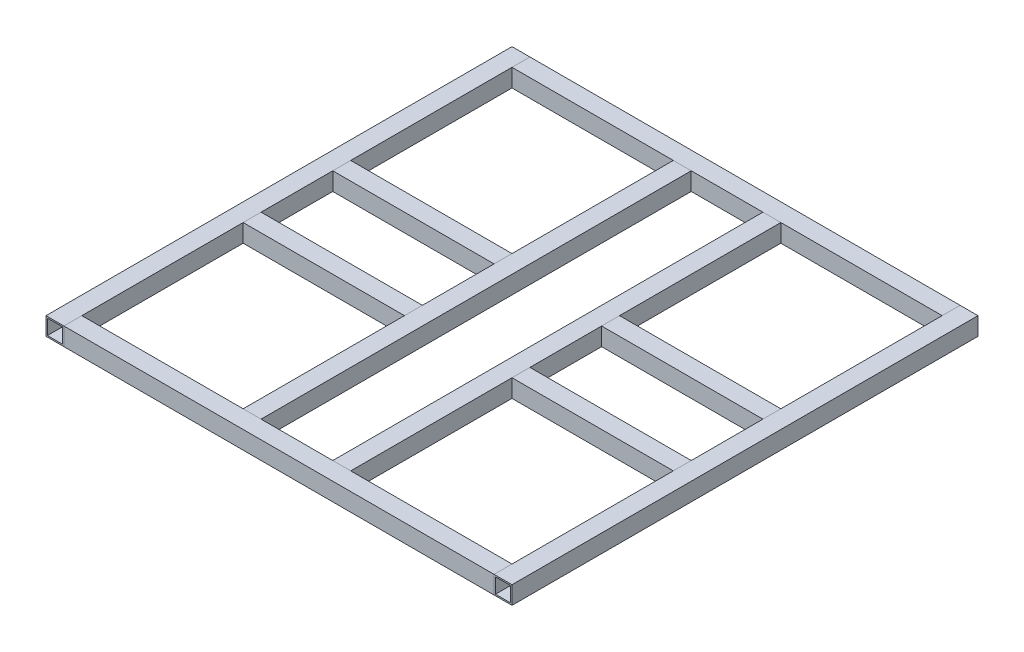
from build123d import *

# Parameters (mm, degrees)
INOX_VU_NG_CONFIGURED_10X0_8_1_DEPTH      = 255
INOX_VU_NG_CONFIGURED_10X0_8_1_DEPTH_BACK = 5
SKETCH11_W                                = 10
SKETCH11_H                                = 10
SKETCH11_W_2                              = 8.4
SKETCH11_H_2                              = 8.4
SKETCH11_ON_SEGMENT_2_W                   = 10
SKETCH11_ON_SEGMENT_2_H                   = 10
SKETCH11_ON_SEGMENT_2_W_2                 = 8.4
SKETCH11_ON_SEGMENT_2_H_2                 = 8.4
INOX_VU_NG_CONFIGURED_10X0_8_1_2_DEPTH    = 252
SKETCH11_ON_SEGMENT_3_W                   = 10
SKETCH11_ON_SEGMENT_3_H                   = 10
SKETCH11_ON_SEGMENT_3_W_2                 = 8.4
SKETCH11_ON_SEGMENT_3_H_2                 = 8.4
INOX_VU_NG_CONFIGURED_10X0_8_1_3_DEPTH    = 252
SKETCH11_ON_SEGMENT_4_W                   = 10
SKETCH11_ON_SEGMENT_4_H                   = 10
SKETCH11_ON_SEGMENT_4_W_2                 = 8.4
SKETCH11_ON_SEGMENT_4_H_2                 = 8.4
INOX_VU_NG_CONFIGURED_10X0_8_1_4_DEPTH    = 260
SKETCH11_ON_SEGMENT_5_W                   = 10
SKETCH11_ON_SEGMENT_5_H                   = 10
SKETCH11_ON_SEGMENT_5_W_2                 = 8.4
SKETCH11_ON_SEGMENT_5_H_2                 = 8.4
INOX_VU_NG_CONFIGURED_10X0_8_1_5_DEPTH    = 252
SKETCH11_ON_SEGMENT_6_W                   = 10
SKETCH11_ON_SEGMENT_6_H                   = 10
SKETCH11_ON_SEGMENT_6_W_2                 = 8.4
SKETCH11_ON_SEGMENT_6_H_2                 = 8.4
INOX_VU_NG_CONFIGURED_10X0_8_1_6_DEPTH    = 252
SKETCH11_ON_SEGMENT_7_W                   = 10
SKETCH11_ON_SEGMENT_7_H                   = 10
SKETCH11_ON_SEGMENT_7_W_2                 = 8.4
SKETCH11_ON_SEGMENT_7_H_2                 = 8.4
INOX_VU_NG_CONFIGURED_10X0_8_1_7_DEPTH    = 102
SKETCH11_ON_SEGMENT_8_W                   = 10
SKETCH11_ON_SEGMENT_8_H                   = 10
SKETCH11_ON_SEGMENT_8_W_2                 = 8.4
SKETCH11_ON_SEGMENT_8_H_2                 = 8.4
INOX_VU_NG_CONFIGURED_10X0_8_1_8_DEPTH    = 102
SKETCH11_ON_SEGMENT_9_W                   = 10
SKETCH11_ON_SEGMENT_9_H                   = 10
SKETCH11_ON_SEGMENT_9_W_2                 = 8.4
SKETCH11_ON_SEGMENT_9_H_2                 = 8.4
INOX_VU_NG_CONFIGURED_10X0_8_1_9_DEPTH    = 102
SKETCH11_ON_SEGMENT_10_W                  = 10
SKETCH11_ON_SEGMENT_10_H                  = 10
SKETCH11_ON_SEGMENT_10_W_2                = 8.4
SKETCH11_ON_SEGMENT_10_H_2                = 8.4
INOX_VU_NG_CONFIGURED_10X0_8_1_10_DEPTH   = 102


with BuildPart() as part:
    # Sketch11 → Inox vuông - configured 10X0.8(1) (new, two sides: drawn at the far end of the back side and taken through both)
    with BuildSketch(Plane(origin=(-125, 0, -125), x_dir=(1, 0, 0), z_dir=(0, 0, 1)).offset(-INOX_VU_NG_CONFIGURED_10X0_8_1_DEPTH_BACK)):
        Rectangle(SKETCH11_W, SKETCH11_H)
        Rectangle(SKETCH11_W_2, SKETCH11_H_2, mode=Mode.SUBTRACT)
    extrude(amount=INOX_VU_NG_CONFIGURED_10X0_8_1_DEPTH + INOX_VU_NG_CONFIGURED_10X0_8_1_DEPTH_BACK)


with BuildPart() as body_2:
    # Sketch11 on segment 2 (carried to segment 2) → Inox vu_ng - configured 10X0.8_1 2 (new body)
    with BuildSketch(Plane(origin=(-25, 0, -126), x_dir=(1, 0, 0), z_dir=(0, 0, 1))):
        Rectangle(SKETCH11_ON_SEGMENT_2_W, SKETCH11_ON_SEGMENT_2_H)
        Rectangle(SKETCH11_ON_SEGMENT_2_W_2, SKETCH11_ON_SEGMENT_2_H_2, mode=Mode.SUBTRACT)
    extrude(amount=INOX_VU_NG_CONFIGURED_10X0_8_1_2_DEPTH)

    # Inox vu_ng - configured 10X0.8_1 2 end b
    split(bisect_by=Plane(origin=(-25, 0, -120), x_dir=(0, -1, 0), z_dir=(0, 0, 1)), keep=Keep.TOP)

    # Inox vu_ng - configured 10X0.8_1 2 e 2
    split(bisect_by=Plane(origin=(-25, 0, 120), x_dir=(0, 1, 0), z_dir=(0, 0, -1)), keep=Keep.TOP)


with BuildPart() as body_3:
    # Sketch11 on segment 3 (carried to segment 3) → Inox vu_ng - configured 10X0.8_1 3 (new body)
    with BuildSketch(Plane(origin=(25, 0, -126), x_dir=(1, 0, 0), z_dir=(0, 0, 1))):
        Rectangle(SKETCH11_ON_SEGMENT_3_W, SKETCH11_ON_SEGMENT_3_H)
        Rectangle(SKETCH11_ON_SEGMENT_3_W_2, SKETCH11_ON_SEGMENT_3_H_2, mode=Mode.SUBTRACT)
    extrude(amount=INOX_VU_NG_CONFIGURED_10X0_8_1_3_DEPTH)

    # Inox vu_ng - configured 10X0.8_1 3 end b
    split(bisect_by=Plane(origin=(25, 0, -120), x_dir=(0, -1, 0), z_dir=(0, 0, 1)), keep=Keep.TOP)

    # Inox vu_ng - configured 10X0.8_1 3 e 2
    split(bisect_by=Plane(origin=(25, 0, 120), x_dir=(0, 1, 0), z_dir=(0, 0, -1)), keep=Keep.TOP)


with BuildPart() as body_4:
    # Sketch11 on segment 4 (carried to segment 4) → Inox vu_ng - configured 10X0.8_1 4 (new body)
    with BuildSketch(Plane(origin=(125, 0, -130), x_dir=(1, 0, 0), z_dir=(0, 0, 1))):
        Rectangle(SKETCH11_ON_SEGMENT_4_W, SKETCH11_ON_SEGMENT_4_H)
        Rectangle(SKETCH11_ON_SEGMENT_4_W_2, SKETCH11_ON_SEGMENT_4_H_2, mode=Mode.SUBTRACT)
    extrude(amount=INOX_VU_NG_CONFIGURED_10X0_8_1_4_DEPTH)


with BuildPart() as body_5:
    # Sketch11 on segment 5 (carried to segment 5) → Inox vu_ng - configured 10X0.8_1 5 (new body)
    with BuildSketch(Plane(origin=(-126, 0, -125), x_dir=(0, 0, -1), z_dir=(1, 0, 0))):
        Rectangle(SKETCH11_ON_SEGMENT_5_W, SKETCH11_ON_SEGMENT_5_H)
        Rectangle(SKETCH11_ON_SEGMENT_5_W_2, SKETCH11_ON_SEGMENT_5_H_2, mode=Mode.SUBTRACT)
    extrude(amount=INOX_VU_NG_CONFIGURED_10X0_8_1_5_DEPTH)

    # Inox vu_ng - configured 10X0.8_1 5 end b
    split(bisect_by=Plane(origin=(-120, 0, -125), x_dir=(0, 1, 0), z_dir=(1, 0, 0)), keep=Keep.TOP)

    # Inox vu_ng - configured 10X0.8_1 5 e 2
    split(bisect_by=Plane(origin=(120, 0, -125), x_dir=(0, -1, 0), z_dir=(-1, 0, 0)), keep=Keep.TOP)


with BuildPart() as body_6:
    # Sketch11 on segment 6 (carried to segment 6) → Inox vu_ng - configured 10X0.8_1 6 (new body)
    with BuildSketch(Plane(origin=(-126, 0, 125), x_dir=(0, 0, -1), z_dir=(1, 0, 0))):
        Rectangle(SKETCH11_ON_SEGMENT_6_W, SKETCH11_ON_SEGMENT_6_H)
        Rectangle(SKETCH11_ON_SEGMENT_6_W_2, SKETCH11_ON_SEGMENT_6_H_2, mode=Mode.SUBTRACT)
    extrude(amount=INOX_VU_NG_CONFIGURED_10X0_8_1_6_DEPTH)

    # Inox vu_ng - configured 10X0.8_1 6 end b
    split(bisect_by=Plane(origin=(-120, 0, 125), x_dir=(0, 1, 0), z_dir=(1, 0, 0)), keep=Keep.TOP)

    # Inox vu_ng - configured 10X0.8_1 6 e 2
    split(bisect_by=Plane(origin=(120, 0, 125), x_dir=(0, -1, 0), z_dir=(-1, 0, 0)), keep=Keep.TOP)


with BuildPart() as body_7:
    # Sketch11 on segment 7 (carried to segment 7) → Inox vu_ng - configured 10X0.8_1 7 (new body)
    with BuildSketch(Plane(origin=(-24, 0, 25), x_dir=(0, 0, 1), z_dir=(-1, 0, 0))):
        Rectangle(SKETCH11_ON_SEGMENT_7_W, SKETCH11_ON_SEGMENT_7_H)
        Rectangle(SKETCH11_ON_SEGMENT_7_W_2, SKETCH11_ON_SEGMENT_7_H_2, mode=Mode.SUBTRACT)
    extrude(amount=INOX_VU_NG_CONFIGURED_10X0_8_1_7_DEPTH)

    # Inox vu_ng - configured 10X0.8_1 7 end b
    split(bisect_by=Plane(origin=(-30, 0, 25), x_dir=(0, -1, 0), z_dir=(-1, 0, 0)), keep=Keep.TOP)

    # Inox vu_ng - configured 10X0.8_1 7 e 2
    split(bisect_by=Plane(origin=(-120, 0, 25), x_dir=(0, 1, 0), z_dir=(1, 0, 0)), keep=Keep.TOP)


with BuildPart() as body_8:
    # Sketch11 on segment 8 (carried to segment 8) → Inox vu_ng - configured 10X0.8_1 8 (new body)
    with BuildSketch(Plane(origin=(-126, 0, -25), x_dir=(0, 0, -1), z_dir=(1, 0, 0))):
        Rectangle(SKETCH11_ON_SEGMENT_8_W, SKETCH11_ON_SEGMENT_8_H)
        Rectangle(SKETCH11_ON_SEGMENT_8_W_2, SKETCH11_ON_SEGMENT_8_H_2, mode=Mode.SUBTRACT)
    extrude(amount=INOX_VU_NG_CONFIGURED_10X0_8_1_8_DEPTH)

    # Inox vu_ng - configured 10X0.8_1 8 end b
    split(bisect_by=Plane(origin=(-120, 0, -25), x_dir=(0, 1, 0), z_dir=(1, 0, 0)), keep=Keep.TOP)

    # Inox vu_ng - configured 10X0.8_1 8 e 2
    split(bisect_by=Plane(origin=(-30, 0, -25), x_dir=(0, -1, 0), z_dir=(-1, 0, 0)), keep=Keep.TOP)


with BuildPart() as body_9:
    # Sketch11 on segment 9 (carried to segment 9) → Inox vu_ng - configured 10X0.8_1 9 (new body)
    with BuildSketch(Plane(origin=(24, 0, -25), x_dir=(0, 0, -1), z_dir=(1, 0, 0))):
        Rectangle(SKETCH11_ON_SEGMENT_9_W, SKETCH11_ON_SEGMENT_9_H)
        Rectangle(SKETCH11_ON_SEGMENT_9_W_2, SKETCH11_ON_SEGMENT_9_H_2, mode=Mode.SUBTRACT)
    extrude(amount=INOX_VU_NG_CONFIGURED_10X0_8_1_9_DEPTH)

    # Inox vu_ng - configured 10X0.8_1 9 end b
    split(bisect_by=Plane(origin=(30, 0, -25), x_dir=(0, 1, 0), z_dir=(1, 0, 0)), keep=Keep.TOP)

    # Inox vu_ng - configured 10X0.8_1 9 e 2
    split(bisect_by=Plane(origin=(120, 0, -25), x_dir=(0, -1, 0), z_dir=(-1, 0, 0)), keep=Keep.TOP)


with BuildPart() as body_10:
    # Sketch11 on segment 10 (carried to segment 10) → Inox vu_ng - configured 10X0.8_1 10 (new body)
    with BuildSketch(Plane(origin=(24, 0, 25), x_dir=(0, 0, -1), z_dir=(1, 0, 0))):
        Rectangle(SKETCH11_ON_SEGMENT_10_W, SKETCH11_ON_SEGMENT_10_H)
        Rectangle(SKETCH11_ON_SEGMENT_10_W_2, SKETCH11_ON_SEGMENT_10_H_2, mode=Mode.SUBTRACT)
    extrude(amount=INOX_VU_NG_CONFIGURED_10X0_8_1_10_DEPTH)

    # Inox vu_ng - configured 10X0.8_1 10 end
    split(bisect_by=Plane(origin=(30, 0, 25), x_dir=(0, 1, 0), z_dir=(1, 0, 0)), keep=Keep.TOP)

    # Inox vu_ng - configured 10X0.8_1 10  2
    split(bisect_by=Plane(origin=(120, 0, 25), x_dir=(0, -1, 0), z_dir=(-1, 0, 0)), keep=Keep.TOP)


solid = Compound([part.part, body_2.part, body_3.part, body_4.part, body_5.part, body_6.part, body_7.part, body_8.part, body_9.part, body_10.part])
